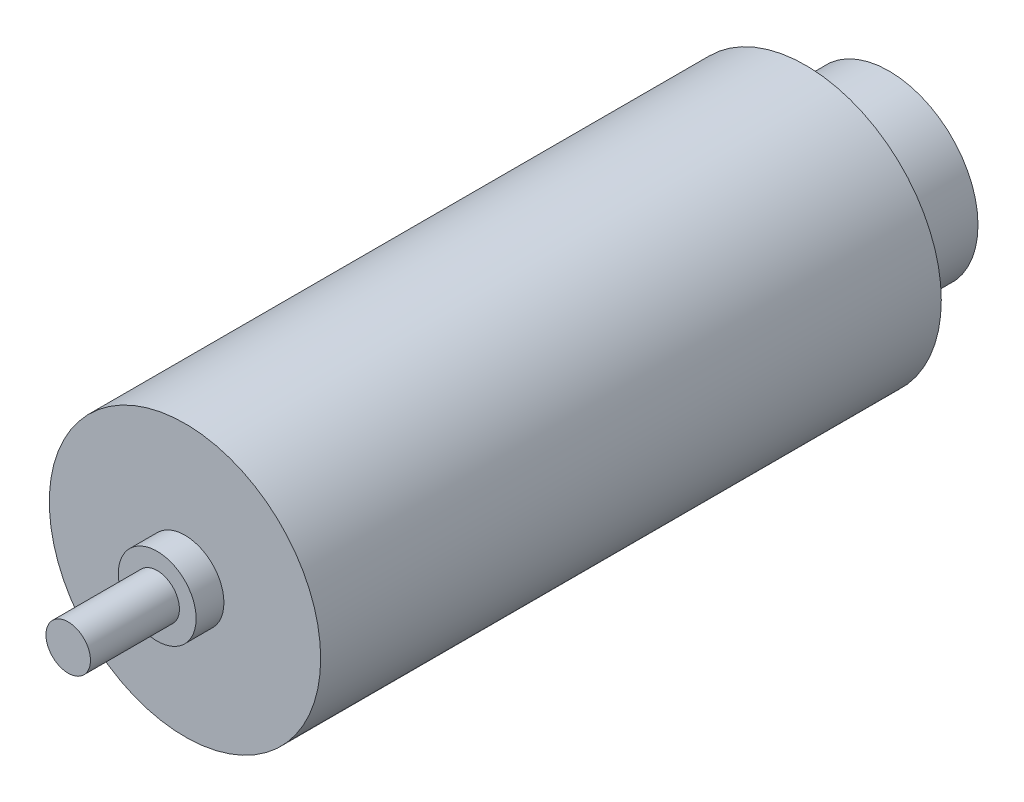
from build123d import *

# Parameters (mm, degrees)
SKETCH1_R           = 12.2
BOSS_EXTRUDE1_DEPTH = 55.8
SKETCH2_R           = 8
BOSS_EXTRUDE2_DEPTH = 7.5
SKETCH3_R           = 3.5
BOSS_EXTRUDE3_DEPTH = 2.5
SKETCH4_R           = 2
BOSS_EXTRUDE4_DEPTH = 8


with BuildPart() as part:
    # Sketch1 → Boss-Extrude1 (new body)
    with BuildSketch(Plane.XY):
        Circle(SKETCH1_R)
    extrude(amount=BOSS_EXTRUDE1_DEPTH)

    # Sketch2 → Boss-Extrude2 (add)
    with BuildSketch(Plane(origin=(0, 0, 0), x_dir=(-1, 0, 0), z_dir=(0, 0, -1))):
        with Locations(Location((0, 0, 0), (0, 0, 180))):
            Circle(SKETCH2_R)
    extrude(amount=BOSS_EXTRUDE2_DEPTH)

    # Sketch3 → Boss-Extrude3 (add)
    with BuildSketch(Plane.XY.offset(55.8)):
        Circle(SKETCH3_R)
    extrude(amount=BOSS_EXTRUDE3_DEPTH)

    # Sketch4 → Boss-Extrude4 (add)
    with BuildSketch(Plane.XY.offset(58.3)):
        Circle(SKETCH4_R)
    extrude(amount=BOSS_EXTRUDE4_DEPTH)


solid = part.part
